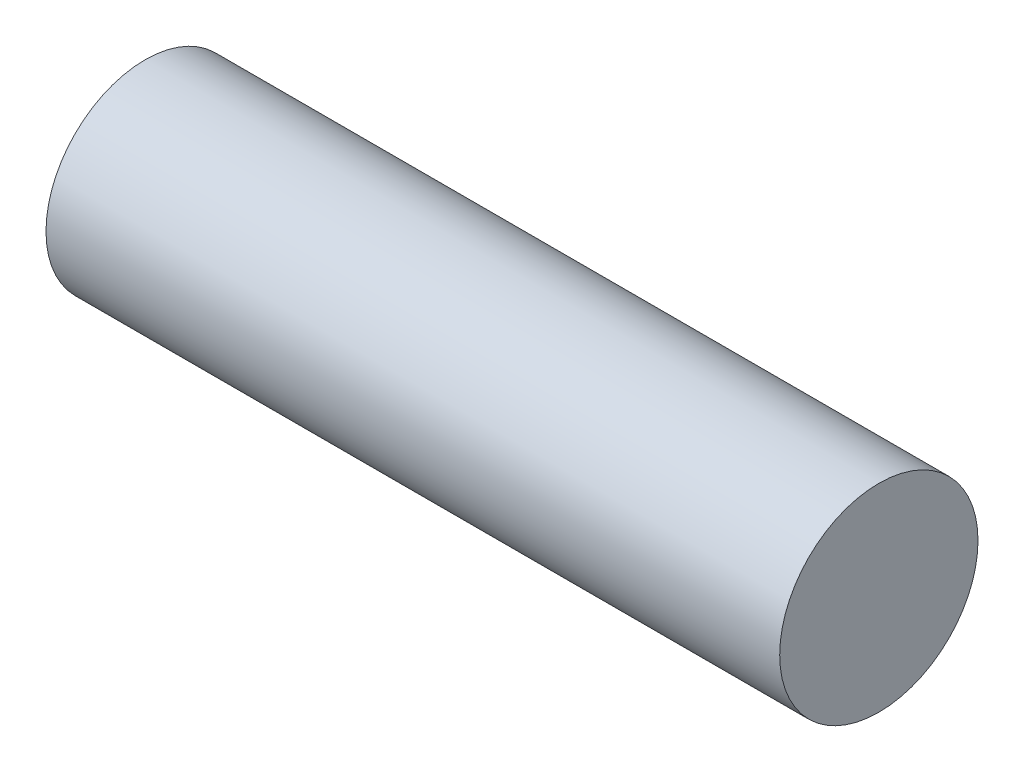
from build123d import *

# Parameters (mm, degrees)
SKETCH1_R           = 5
BOSS_EXTRUDE1_DEPTH = 18.5


with BuildPart() as part:
    # Sketch1 → Boss-Extrude1 (new, symmetric)
    with BuildSketch(Plane(origin=(0, 0, 0), x_dir=(0, 0, -1), z_dir=(1, 0, 0))):
        Circle(SKETCH1_R)
    extrude(amount=BOSS_EXTRUDE1_DEPTH, both=True)


solid = part.part
